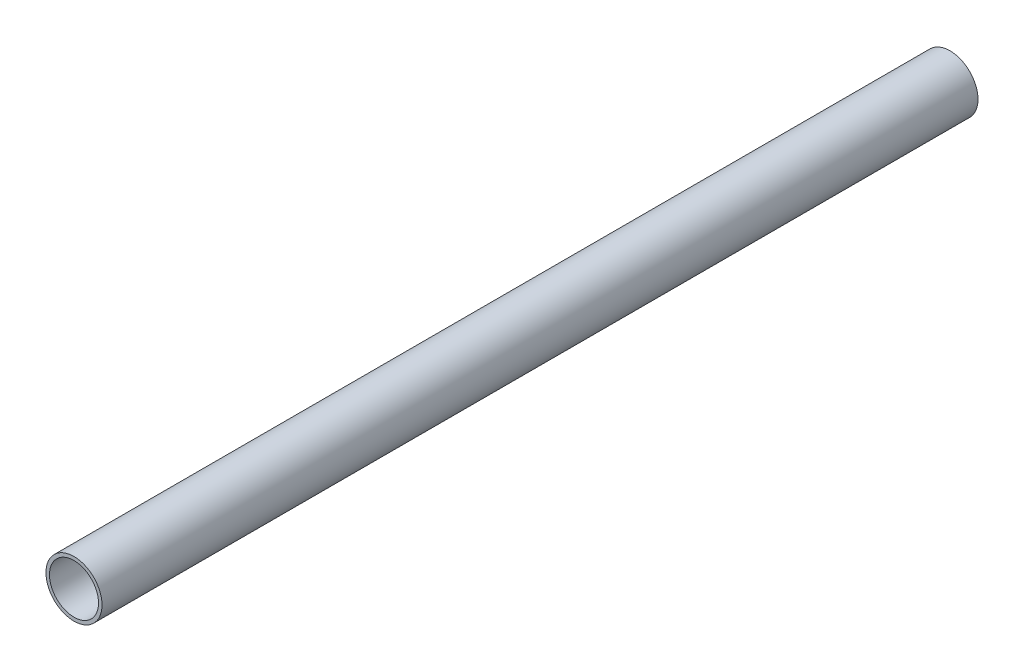
from build123d import *

# Parameters (mm, degrees)
SKETCH1_R           = 8
SKETCH1_R_2         = 7
BOSS_EXTRUDE1_DEPTH = 250


with BuildPart() as part:
    # Sketch1 → Boss-Extrude1 (new body)
    with BuildSketch(Plane.XY):
        Circle(SKETCH1_R)
        Circle(SKETCH1_R_2, mode=Mode.SUBTRACT)
    extrude(amount=BOSS_EXTRUDE1_DEPTH)


solid = part.part
